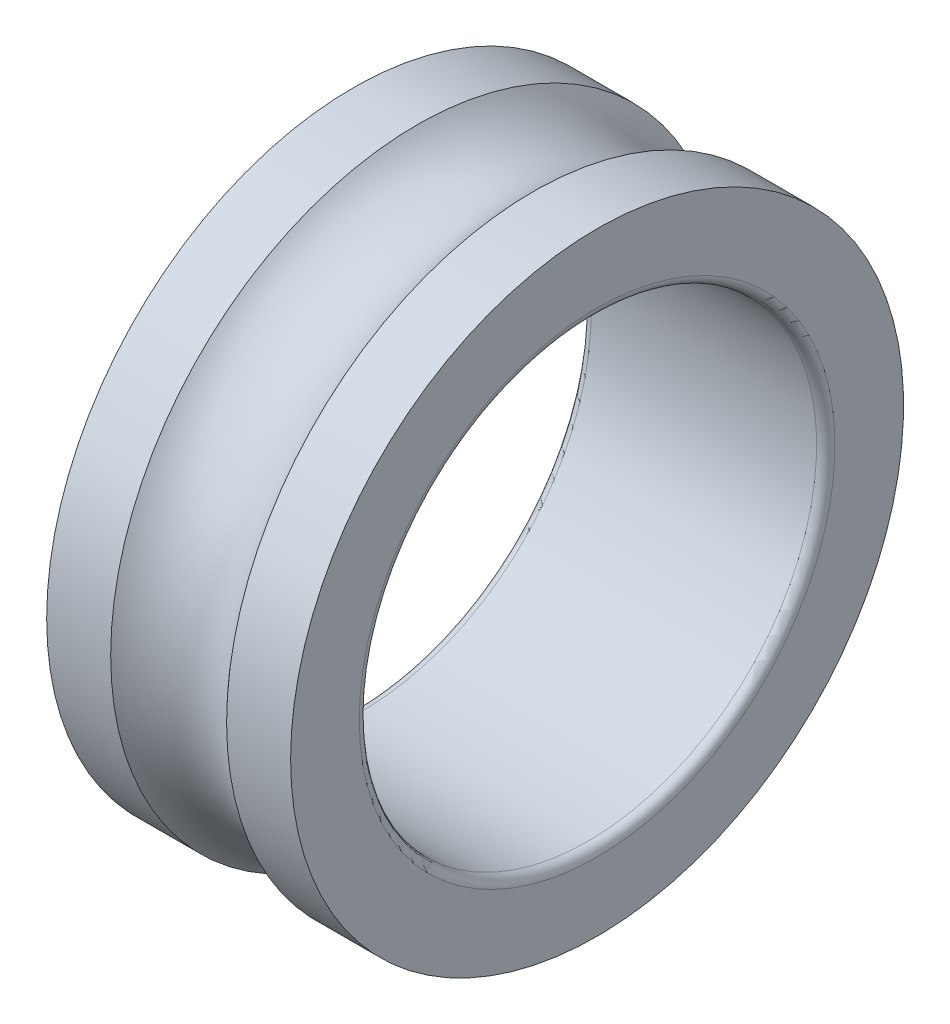
from build123d import *


with BuildPart() as part:
    # Esquisse1 → Base-Révolution (revolve)
    with BuildSketch(Plane(origin=(0, 0, 0), x_dir=(1, 0, 0), z_dir=(0, 1, 0))):
        with BuildLine():
            Line((0, 10.05), (0, 7.8))
            ThreePointArc((0, 7.8), (0.087867966, 7.587867966), (0.3, 7.5))
            Line((0.3, 7.5), (7.7, 7.5))
            ThreePointArc((7.7, 7.5), (7.912132034, 7.587867966), (8, 7.8))
            Line((8, 7.8), (8, 10.05))
            Line((8, 10.05), (5.900657781, 10.05))
            ThreePointArc((5.900657781, 10.05), (4, 9.2), (2.099342219, 10.05))
            Line((2.099342219, 10.05), (0, 10.05))
        make_face()
    revolve(axis=Axis((0, 0, 0), (1, 0, 0)))


solid = part.part
